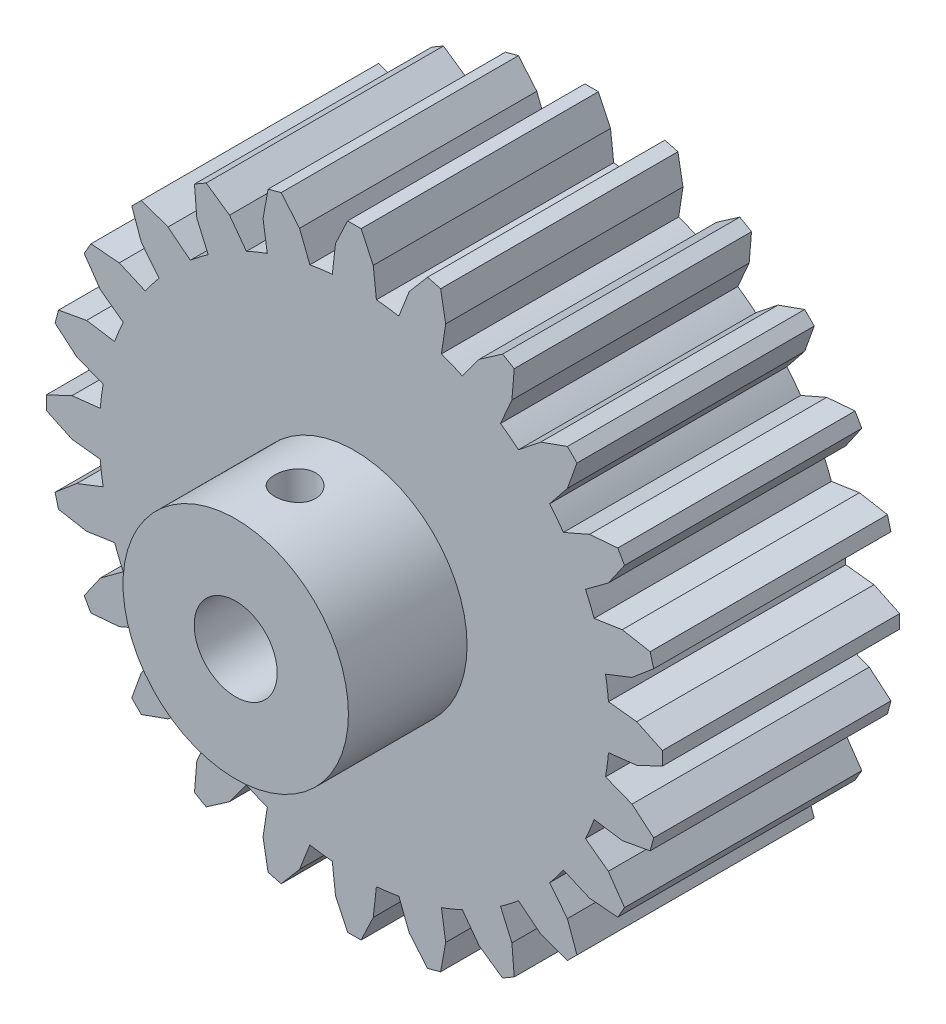
from build123d import *

# Parameters (mm, degrees)
ESQUISSE1_R             = 3.5
BOSS_EXTRU_1_DEPTH      = 20
ESQUISSE2_R             = 9.5
ESQUISSE2_R_2           = 3.5
BOSS_EXTRU_2_DEPTH      = 10
ESQUISSE3_R             = 1.725
ENL_V_MAT_EXTRU_1_DEPTH = 10


with BuildPart() as part:
    # Esquisse1 → Boss.-Extru.1 (new body)
    with BuildSketch(Plane.XY):
        with BuildLine():
            Line((-1.8585, 21.419523285), (-1.591531907, 23.799597451))
            Line((-1.591531907, 23.799597451), (-0.5695, 25.965578933))
            Line((-0.5695, 25.965578933), (0.5695, 25.965578933))
            Line((0.5695, 25.965578933), (1.591531907, 23.799597451))
            Line((1.591531907, 23.799597451), (1.8585, 21.419523285))
            ThreePointArc((1.8585, 21.419523285), (2.806313133, 21.31606452), (3.748607415, 21.170685923))
            Line((3.748607415, 21.170685923), (4.622487313, 23.400564602))
            Line((4.622487313, 23.400564602), (6.170291587, 25.228220732))
            Line((6.170291587, 25.228220732), (7.270481103, 24.93342584))
            Line((7.270481103, 24.93342584), (7.697090859, 22.576727065))
            Line((7.697090859, 22.576727065), (7.338953711, 20.208655532))
            ThreePointArc((7.338953711, 20.208655532), (8.227693796, 19.863409949), (9.100253429, 19.479101302))
            Line((9.100253429, 19.479101302), (10.521491663, 21.406821946))
            Line((10.521491663, 21.406821946), (12.489587999, 22.77160098))
            Line((12.489587999, 22.77160098), (13.475990934, 22.20210098))
            Line((13.475990934, 22.20210098), (13.278105788, 19.815290039))
            Line((13.278105788, 19.815290039), (12.319269855, 17.620601302))
            ThreePointArc((12.319269855, 17.620601302), (13.088370724, 17.057096816), (13.831732212, 16.460048117))
            Line((13.831732212, 16.460048117), (15.703473743, 17.954239751))
            Line((15.703473743, 17.954239751), (17.957739629, 18.763134253))
            Line((17.957739629, 18.763134253), (18.763134253, 17.957739629))
            Line((18.763134253, 17.957739629), (17.954239751, 15.703473743))
            Line((17.954239751, 15.703473743), (16.460048117, 13.831732212))
            ThreePointArc((16.460048117, 13.831732212), (17.057096816, 13.088370724), (17.620601302, 12.319269855))
            Line((17.620601302, 12.319269855), (19.815290039, 13.278105788))
            Line((19.815290039, 13.278105788), (22.20210098, 13.475990934))
            Line((22.20210098, 13.475990934), (22.77160098, 12.489587999))
            Line((22.77160098, 12.489587999), (21.406821946, 10.521491663))
            Line((21.406821946, 10.521491663), (19.479101302, 9.100253429))
            ThreePointArc((19.479101302, 9.100253429), (19.863409949, 8.227693796), (20.208655532, 7.338953711))
            Line((20.208655532, 7.338953711), (22.576727065, 7.697090859))
            Line((22.576727065, 7.697090859), (24.93342584, 7.270481103))
            Line((24.93342584, 7.270481103), (25.228220732, 6.170291587))
            Line((25.228220732, 6.170291587), (23.400564602, 4.622487313))
            Line((23.400564602, 4.622487313), (21.170685923, 3.748607415))
            ThreePointArc((21.170685923, 3.748607415), (21.31606452, 2.806313133), (21.419523285, 1.8585))
            Line((21.419523285, 1.8585), (23.799597451, 1.591531907))
            Line((23.799597451, 1.591531907), (25.965578933, 0.5695))
            Line((25.965578933, 0.5695), (25.965578933, -0.5695))
            Line((25.965578933, -0.5695), (23.799597451, -1.591531907))
            Line((23.799597451, -1.591531907), (21.419523285, -1.8585))
            ThreePointArc((21.419523285, -1.8585), (21.31606452, -2.806313133), (21.170685923, -3.748607415))
            Line((21.170685923, -3.748607415), (23.400564602, -4.622487313))
            Line((23.400564602, -4.622487313), (25.228220732, -6.170291587))
            Line((25.228220732, -6.170291587), (24.93342584, -7.270481103))
            Line((24.93342584, -7.270481103), (22.576727065, -7.697090859))
            Line((22.576727065, -7.697090859), (20.208655532, -7.338953711))
            ThreePointArc((20.208655532, -7.338953711), (19.863409949, -8.227693796), (19.479101302, -9.100253429))
            Line((19.479101302, -9.100253429), (21.406821946, -10.521491663))
            Line((21.406821946, -10.521491663), (22.77160098, -12.489587999))
            Line((22.77160098, -12.489587999), (22.20210098, -13.475990934))
            Line((22.20210098, -13.475990934), (19.815290039, -13.278105788))
            Line((19.815290039, -13.278105788), (17.620601302, -12.319269855))
            ThreePointArc((17.620601302, -12.319269855), (17.057096816, -13.088370724), (16.460048117, -13.831732212))
            Line((16.460048117, -13.831732212), (17.954239751, -15.703473743))
            Line((17.954239751, -15.703473743), (18.763134253, -17.957739629))
            Line((18.763134253, -17.957739629), (17.957739629, -18.763134253))
            Line((17.957739629, -18.763134253), (15.703473743, -17.954239751))
            Line((15.703473743, -17.954239751), (13.831732212, -16.460048117))
            ThreePointArc((13.831732212, -16.460048117), (13.088370724, -17.057096816), (12.319269855, -17.620601302))
            Line((12.319269855, -17.620601302), (13.278105788, -19.815290039))
            Line((13.278105788, -19.815290039), (13.475990934, -22.20210098))
            Line((13.475990934, -22.20210098), (12.489587999, -22.77160098))
            Line((12.489587999, -22.77160098), (10.521491663, -21.406821946))
            Line((10.521491663, -21.406821946), (9.100253429, -19.479101302))
            ThreePointArc((9.100253429, -19.479101302), (8.227693796, -19.863409949), (7.338953711, -20.208655532))
            Line((7.338953711, -20.208655532), (7.697090859, -22.576727065))
            Line((7.697090859, -22.576727065), (7.270481103, -24.93342584))
            Line((7.270481103, -24.93342584), (6.170291587, -25.228220732))
            Line((6.170291587, -25.228220732), (4.622487313, -23.400564602))
            Line((4.622487313, -23.400564602), (3.748607415, -21.170685923))
            ThreePointArc((3.748607415, -21.170685923), (2.806313133, -21.31606452), (1.8585, -21.419523285))
            Line((1.8585, -21.419523285), (1.591531907, -23.799597451))
            Line((1.591531907, -23.799597451), (0.5695, -25.965578933))
            Line((0.5695, -25.965578933), (-0.5695, -25.965578933))
            Line((-0.5695, -25.965578933), (-1.591531907, -23.799597451))
            Line((-1.591531907, -23.799597451), (-1.8585, -21.419523285))
            ThreePointArc((-1.8585, -21.419523285), (-2.806313133, -21.31606452), (-3.748607415, -21.170685923))
            Line((-3.748607415, -21.170685923), (-4.622487313, -23.400564602))
            Line((-4.622487313, -23.400564602), (-6.170291587, -25.228220732))
            Line((-6.170291587, -25.228220732), (-7.270481103, -24.93342584))
            Line((-7.270481103, -24.93342584), (-7.697090859, -22.576727065))
            Line((-7.697090859, -22.576727065), (-7.338953711, -20.208655532))
            ThreePointArc((-7.338953711, -20.208655532), (-8.227693796, -19.863409949), (-9.100253429, -19.479101302))
            Line((-9.100253429, -19.479101302), (-10.521491663, -21.406821946))
            Line((-10.521491663, -21.406821946), (-12.489587999, -22.77160098))
            Line((-12.489587999, -22.77160098), (-13.475990934, -22.20210098))
            Line((-13.475990934, -22.20210098), (-13.278105788, -19.815290039))
            Line((-13.278105788, -19.815290039), (-12.319269855, -17.620601302))
            ThreePointArc((-12.319269855, -17.620601302), (-13.088370724, -17.057096816), (-13.831732212, -16.460048117))
            Line((-13.831732212, -16.460048117), (-15.703473743, -17.954239751))
            Line((-15.703473743, -17.954239751), (-17.957739629, -18.763134253))
            Line((-17.957739629, -18.763134253), (-18.763134253, -17.957739629))
            Line((-18.763134253, -17.957739629), (-17.954239751, -15.703473743))
            Line((-17.954239751, -15.703473743), (-16.460048117, -13.831732212))
            ThreePointArc((-16.460048117, -13.831732212), (-17.057096816, -13.088370724), (-17.620601302, -12.319269855))
            Line((-17.620601302, -12.319269855), (-19.815290039, -13.278105788))
            Line((-19.815290039, -13.278105788), (-22.20210098, -13.475990934))
            Line((-22.20210098, -13.475990934), (-22.77160098, -12.489587999))
            Line((-22.77160098, -12.489587999), (-21.406821946, -10.521491663))
            Line((-21.406821946, -10.521491663), (-19.479101302, -9.100253429))
            ThreePointArc((-19.479101302, -9.100253429), (-19.863409949, -8.227693796), (-20.208655532, -7.338953711))
            Line((-20.208655532, -7.338953711), (-22.576727065, -7.697090859))
            Line((-22.576727065, -7.697090859), (-24.93342584, -7.270481103))
            Line((-24.93342584, -7.270481103), (-25.228220732, -6.170291587))
            Line((-25.228220732, -6.170291587), (-23.400564602, -4.622487313))
            Line((-23.400564602, -4.622487313), (-21.170685923, -3.748607415))
            ThreePointArc((-21.170685923, -3.748607415), (-21.31606452, -2.806313133), (-21.419523285, -1.8585))
            Line((-21.419523285, -1.8585), (-23.799597451, -1.591531907))
            Line((-23.799597451, -1.591531907), (-25.965578933, -0.5695))
            Line((-25.965578933, -0.5695), (-25.965578933, 0.5695))
            Line((-25.965578933, 0.5695), (-23.799597451, 1.591531907))
            Line((-23.799597451, 1.591531907), (-21.419523285, 1.8585))
            ThreePointArc((-21.419523285, 1.8585), (-21.31606452, 2.806313133), (-21.170685923, 3.748607415))
            Line((-21.170685923, 3.748607415), (-23.400564602, 4.622487313))
            Line((-23.400564602, 4.622487313), (-25.228220732, 6.170291587))
            Line((-25.228220732, 6.170291587), (-24.93342584, 7.270481103))
            Line((-24.93342584, 7.270481103), (-22.576727065, 7.697090859))
            Line((-22.576727065, 7.697090859), (-20.208655532, 7.338953711))
            ThreePointArc((-20.208655532, 7.338953711), (-19.863409949, 8.227693796), (-19.479101302, 9.100253429))
            Line((-19.479101302, 9.100253429), (-21.406821946, 10.521491663))
            Line((-21.406821946, 10.521491663), (-22.77160098, 12.489587999))
            Line((-22.77160098, 12.489587999), (-22.20210098, 13.475990934))
            Line((-22.20210098, 13.475990934), (-19.815290039, 13.278105788))
            Line((-19.815290039, 13.278105788), (-17.620601302, 12.319269855))
            ThreePointArc((-17.620601302, 12.319269855), (-17.057096816, 13.088370724), (-16.460048117, 13.831732212))
            Line((-16.460048117, 13.831732212), (-17.954239751, 15.703473743))
            Line((-17.954239751, 15.703473743), (-18.763134253, 17.957739629))
            Line((-18.763134253, 17.957739629), (-17.957739629, 18.763134253))
            Line((-17.957739629, 18.763134253), (-15.703473743, 17.954239751))
            Line((-15.703473743, 17.954239751), (-13.831732212, 16.460048117))
            ThreePointArc((-13.831732212, 16.460048117), (-13.088370724, 17.057096816), (-12.319269855, 17.620601302))
            Line((-12.319269855, 17.620601302), (-13.278105788, 19.815290039))
            Line((-13.278105788, 19.815290039), (-13.475990934, 22.20210098))
            Line((-13.475990934, 22.20210098), (-12.489587999, 22.77160098))
            Line((-12.489587999, 22.77160098), (-10.521491663, 21.406821946))
            Line((-10.521491663, 21.406821946), (-9.100253429, 19.479101302))
            ThreePointArc((-9.100253429, 19.479101302), (-8.227693796, 19.863409949), (-7.338953711, 20.208655532))
            Line((-7.338953711, 20.208655532), (-7.697090859, 22.576727065))
            Line((-7.697090859, 22.576727065), (-7.270481103, 24.93342584))
            Line((-7.270481103, 24.93342584), (-6.170291587, 25.228220732))
            Line((-6.170291587, 25.228220732), (-4.622487313, 23.400564602))
            Line((-4.622487313, 23.400564602), (-3.748607415, 21.170685923))
            ThreePointArc((-3.748607415, 21.170685923), (-2.806313133, 21.31606452), (-1.8585, 21.419523285))
        make_face()
        Circle(ESQUISSE1_R, mode=Mode.SUBTRACT)
    extrude(amount=BOSS_EXTRU_1_DEPTH)

    # Esquisse2 → Boss.-Extru.2 (add)
    with BuildSketch(Plane.XY.offset(20)):
        Circle(ESQUISSE2_R)
        Circle(ESQUISSE2_R_2, mode=Mode.SUBTRACT)
    extrude(amount=BOSS_EXTRU_2_DEPTH)

    # Esquisse3 → Enlèv. mat.-Extru.1 (cut)
    with BuildSketch(Plane(origin=(0, 0, 0), x_dir=(1, 0, 0), z_dir=(0, 1, 0))):
        with Locations(Location((0, -25, 0), (0, 0, 90))):
            Circle(ESQUISSE3_R)
    extrude(amount=ENL_V_MAT_EXTRU_1_DEPTH, mode=Mode.SUBTRACT)


solid = part.part
